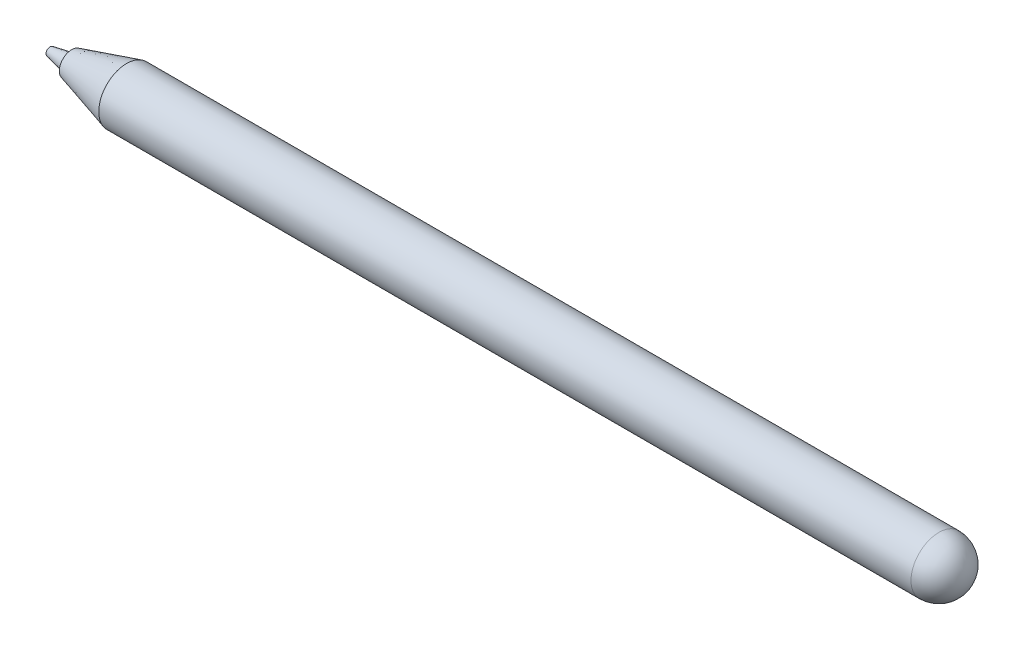
from build123d import *

# Parameters (mm, degrees)
SKETCH_9_W = 658.509048611
SKETCH_9_H = 24.697729226


with BuildPart() as part:
    # 草图4 → 旋转2 (revolve)
    with BuildSketch(Plane.XY, mode=Mode.PRIVATE) as revolve_2_sk:
        Polygon((0, 0), (111.810339883, 0), (111.810339883, 24.697729226), (48.776692206, 24.697729226), (0, 10.944933369), align=None)
    revolve(revolve_2_sk.sketch.rotate(Axis((0, 0, 0), (1, 0, 0)), 90), axis=Axis((0, 0, 0), (1, 0, 0)))

    # 草图9 → 旋转4 (revolve)
    with BuildSketch(Plane.XY, mode=Mode.PRIVATE) as revolve_4_sk:
        with Locations((441.064864188, 12.348864613)):
            Rectangle(SKETCH_9_W, SKETCH_9_H)
    revolve(revolve_4_sk.sketch.rotate(Axis((111.810339883, 0, 0), (1, 0, 0)), 90), axis=Axis((111.810339883, 0, 0), (1, 0, 0)))

    # 草图10 → 旋转5 (revolve)
    with BuildSketch(Plane.XY):
        with BuildLine():
            Line((770.319388494, 0), (795.01711772, 0))
            ThreePointArc((795.01711772, 0), (787.78332031, 17.463931816), (770.319388494, 24.697729226))
            Line((770.319388494, 24.697729226), (770.319388494, 0))
        make_face()
    revolve(axis=Axis((0, 0, 0), (1, 0, 0)))


with BuildPart() as body_2:
    # 草图6 → 旋转3 (revolve)
    with BuildSketch(Plane.XY, mode=Mode.PRIVATE) as revolve_3_sk:
        Polygon((0, -0.46798709), (0, 6.961864729), (-19.188758431, 3.540723799), (-19.188758431, 0), align=None)
    revolve(revolve_3_sk.sketch.rotate(Axis((-19.188758431, 0, 0), (0.9997027305288129, -0.024381357083554822, 0)), 180), axis=Axis((-19.188758431, 0, 0), (0.9997027305288129, -0.024381357083554822, 0)))


solid = Compound([part.part, body_2.part])
